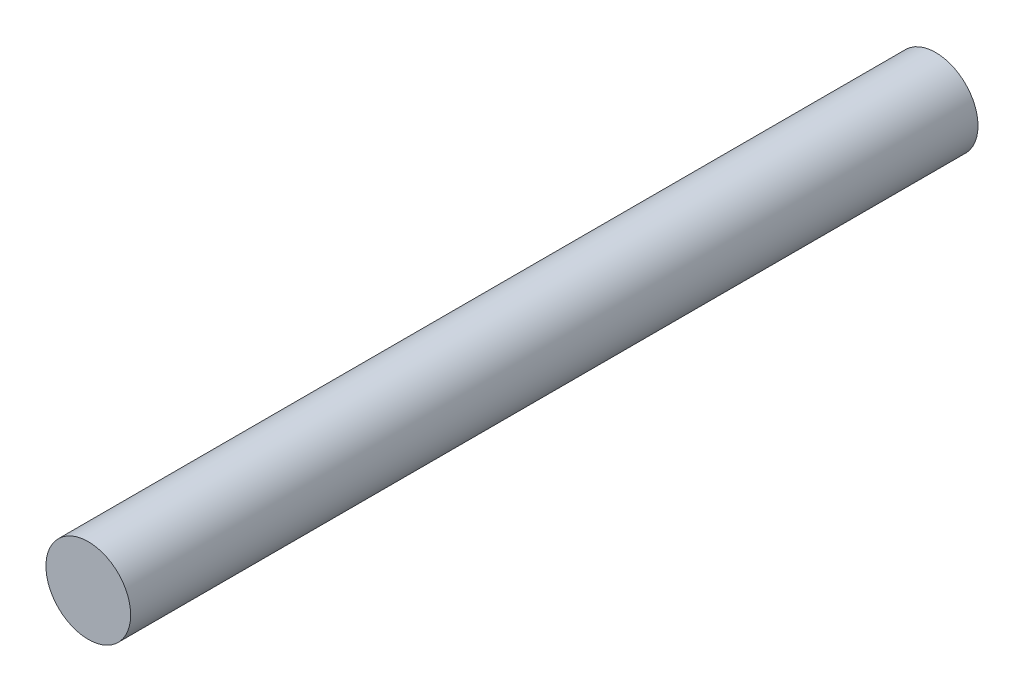
from build123d import *

# Parameters (mm, degrees)
SKETCH_1_R      = 1.25
EXTRUDE_1_DEPTH = 25


with BuildPart() as part:
    # 草图1 → 凸台-拉伸1 (new body)
    with BuildSketch(Plane.XY):
        Circle(SKETCH_1_R)
    extrude(amount=EXTRUDE_1_DEPTH)


solid = part.part
